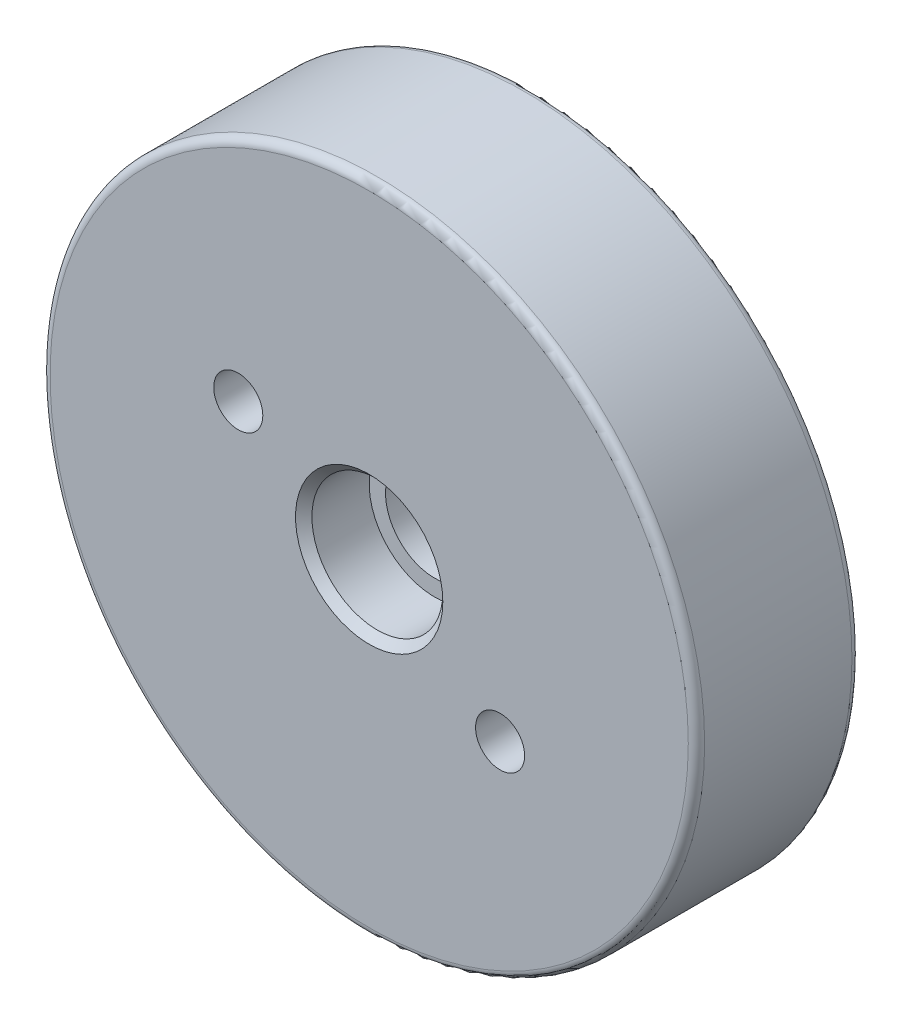
from build123d import *

# Parameters (mm, degrees)
SKETCH_1_R          = 20
EXTRUDE_1_DEPTH     = 10
SKETCH_2_R          = 3
CUT_EXTRUDE_1_DEPTH = 10
SKETCH_3_R          = 4
CUT_EXTRUDE_2_DEPTH = 4
FILLET_1_R          = 0.5
CHAMFER_1_SIZE      = 0.5
CHAMFER_2_SIZE      = 0.5
SKETCH_6_R          = 1.5
CUT_EXTRUDE_7_DEPTH = 6


with BuildPart() as part:
    # 草图1 → 凸台-拉伸1 (new body)
    with BuildSketch(Plane.XY):
        Circle(SKETCH_1_R)
    extrude(amount=EXTRUDE_1_DEPTH)

    # 草图2 → 切除-拉伸1 (cut)
    with BuildSketch(Plane.XY.offset(10)):
        Circle(SKETCH_2_R)
    extrude(amount=-CUT_EXTRUDE_1_DEPTH, mode=Mode.SUBTRACT)

    # 草图3 → 切除-拉伸2 (cut)
    with BuildSketch(Plane.XY.offset(10)):
        Circle(SKETCH_3_R)
    extrude(amount=-CUT_EXTRUDE_2_DEPTH, mode=Mode.SUBTRACT)

    # 圆角1
    fillet_1_edges = [part.edges().sort_by_distance(p)[0] for p in [
        (-20, 0, 0),
        (-20, 0, 10),
    ]]
    fillet(fillet_1_edges, radius=FILLET_1_R)

    # 倒角1
    chamfer_1_edges = [part.edges().sort_by_distance(p)[0] for p in [
        (-3, 0, 0),
    ]]
    chamfer(chamfer_1_edges, length=CHAMFER_1_SIZE)

    # 倒角2
    chamfer_2_edges = [part.edges().sort_by_distance(p)[0] for p in [
        (-4, 0, 10),
    ]]
    chamfer(chamfer_2_edges, length=CHAMFER_2_SIZE)

    # 草图6 → 切除-拉伸7 (cut)
    with BuildSketch(Plane.XY.offset(10)):
        with Locations((-8, 4.353810299)):
            Circle(SKETCH_6_R)
        with Locations((8, -5.646189701)):
            Circle(SKETCH_6_R)
    extrude(amount=-CUT_EXTRUDE_7_DEPTH, mode=Mode.SUBTRACT)


solid = part.part
